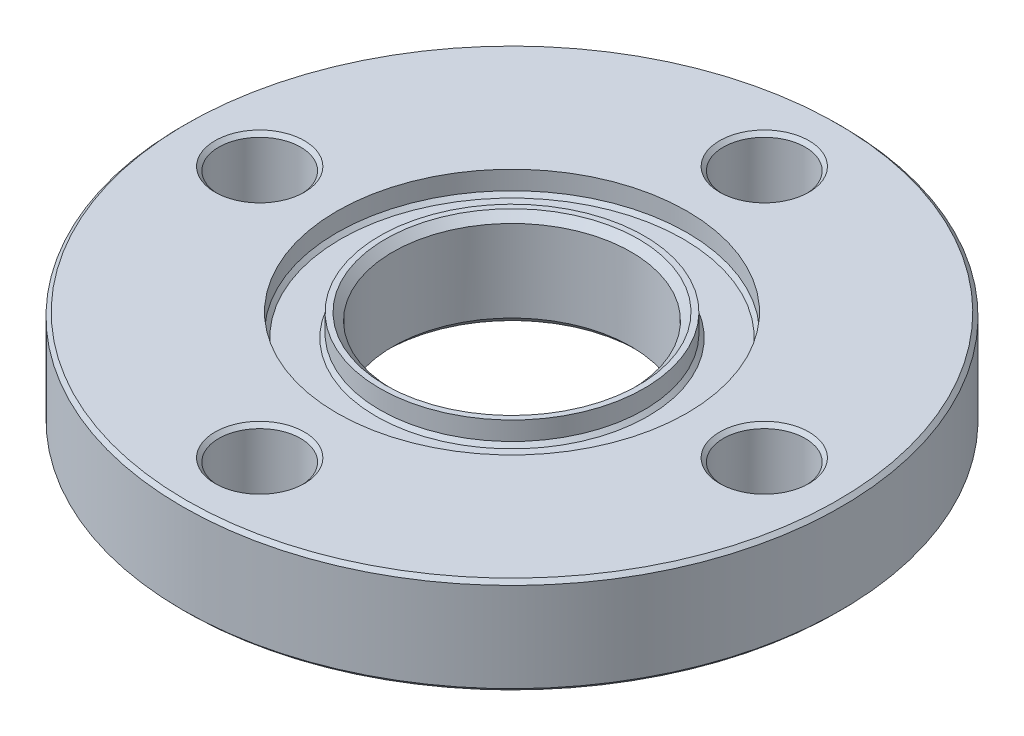
from build123d import *

# Parameters (mm, degrees)
CORTAR_EXTRUIR1_DEPTH      = 63.915618093
CORTAR_EXTRUIR1_DEPTH_BACK = 63.915618093
CROQUIS2_R                 = 5.5
CHAFL_N1_SIZE              = 1
CHAFL_N2_SIZE              = 0.5


with BuildPart() as part:
    # Croquis1 → Revolución1 (revolve)
    with BuildSketch(Plane(origin=(0, 0, 0), x_dir=(0, 0, -1), z_dir=(1, 0, 0))):
        Polygon((-16, -6.5), (-16, 6.5), (-17.75, 6.5), (-17.75, 3.5), (-23.5, 3.5), (-23.5, 6.5), (-44.25, 6.5), (-44.25, -6.5), align=None)
    revolve(axis=Axis((0, 0, 0), (0, -1, 0)))

    # Croquis2 → Cortar-Extruir1 (cut, two sides: drawn at the far end of the back side and taken through both)
    with BuildSketch(Plane(origin=(0, 0, 0), x_dir=(1, 0, 0), z_dir=(0, 1, 0)).offset(-CORTAR_EXTRUIR1_DEPTH_BACK)):
        with Locations(Location((0, 33.875, 0), (0, 0, 270))):
            Circle(CROQUIS2_R)
        with Locations(Location((33.875, 0, 0), (0, 0, 270))):
            Circle(CROQUIS2_R)
        with Locations(Location((0, -33.875, 0), (0, 0, 270))):
            Circle(CROQUIS2_R)
        with Locations(Location((-33.875, 0, 0), (0, 0, 270))):
            Circle(CROQUIS2_R)
    extrude(amount=CORTAR_EXTRUIR1_DEPTH + CORTAR_EXTRUIR1_DEPTH_BACK, mode=Mode.SUBTRACT)

    # Chaflán1
    chafl_n1_edges = [part.edges().sort_by_distance(p)[0] for p in [
        (0, 6.5, -16),
        (0, -6.5, -16),
    ]]
    chamfer(chafl_n1_edges, length=CHAFL_N1_SIZE)

    # Chaflán2
    chafl_n2_edges = [part.edges().sort_by_distance(p)[0] for p in [
        (0, -6.5, -39.375),
        (0, 6.5, -39.375),
        (33.875, -6.5, -5.5),
        (33.875, 6.5, -5.5),
        (0, -6.5, 28.375),
        (0, 6.5, 28.375),
        (-33.875, -6.5, -5.5),
        (-33.875, 6.5, -5.5),
        (0, -6.5, -44.25),
        (0, 6.5, -44.25),
        (0, 3.5, -23.5),
        (0, 3.5, -17.75),
    ]]
    chamfer(chafl_n2_edges, length=CHAFL_N2_SIZE)


solid = part.part
